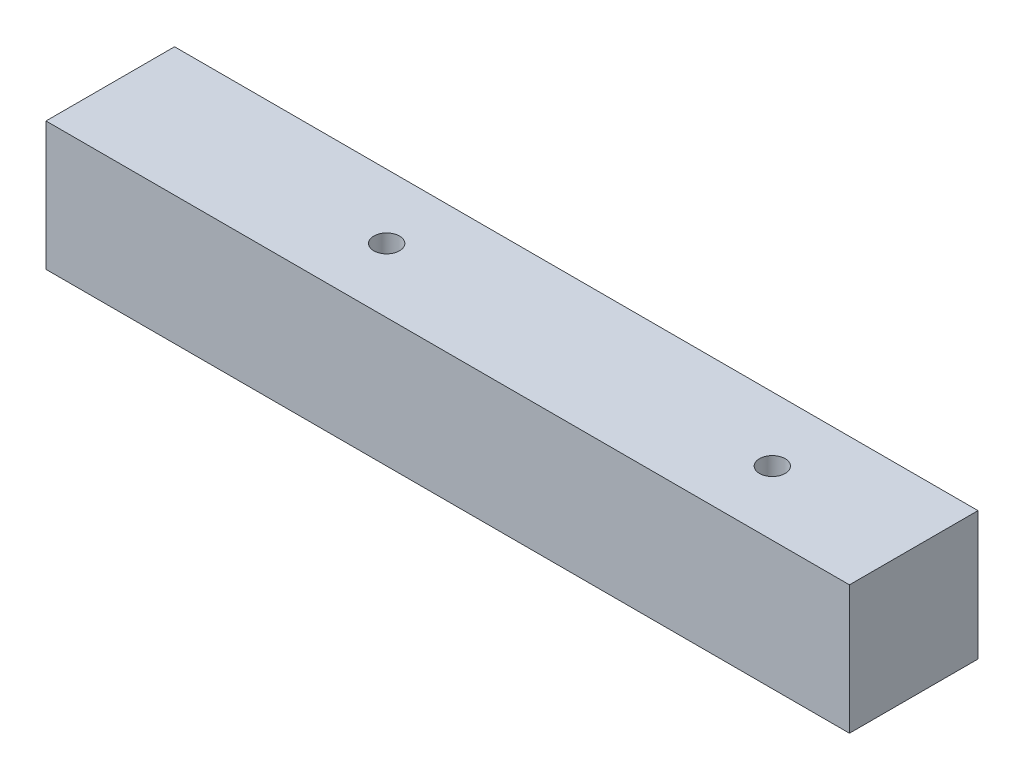
from build123d import *

# Parameters (mm, degrees)
SKETCH_1_W            = 125
SKETCH_1_H            = 20
EXTRUDE_1_DEPTH       = 20
HOLE_WIZARD_4_0_4_1_D = 4


with BuildPart() as part:
    # 草图1 → 凸台-拉伸1 (new body)
    with BuildSketch(Plane(origin=(0, 0, 0), x_dir=(1, 0, 0), z_dir=(0, 1, 0))):
        with Locations((62.5, 10)):
            Rectangle(SKETCH_1_W, SKETCH_1_H)
    extrude(amount=EXTRUDE_1_DEPTH)

    # Ø4.0 (4) 直径孔1 (through all)
    with Locations(Plane(origin=(0, 20, 0), x_dir=(1, 0, 0), z_dir=(0, 1, 0))):
        with Locations((103, 10), (43, 10)):
            Hole(HOLE_WIZARD_4_0_4_1_D / 2)


solid = part.part
